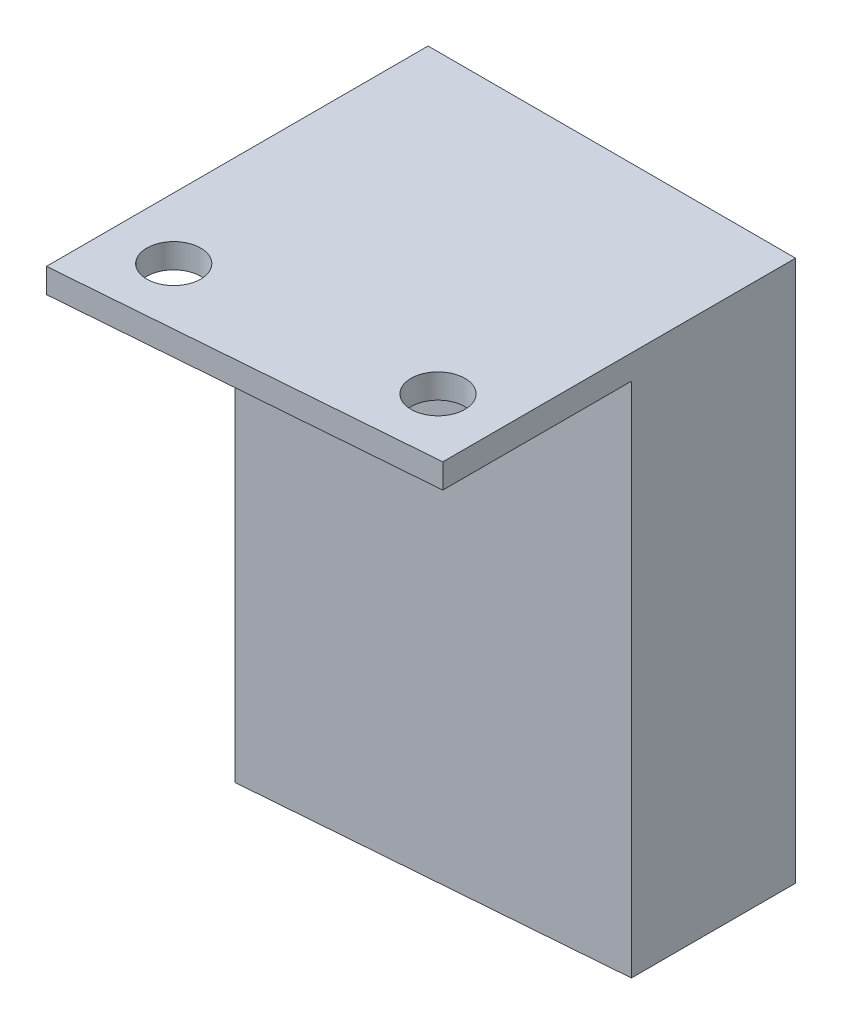
from build123d import *

# Parameters (mm, degrees)
SKETCH1_W           = 38.1
SKETCH1_H           = 25.4
BOSS_EXTRUDE1_DEPTH = 17.018
SKETCH4_W           = 38.1
SKETCH4_H           = 23.368
SKETCH4_R           = 2.794
BOSS_EXTRUDE2_DEPTH = 2.54
CUT_EXTRUDE1_DEPTH  = 62.055704041
BOSS_EXTRUDE3_DEPTH = 22.86
BOSS_EXTRUDE5_DEPTH = 30.734
SKETCH11_R          = 2.0193
CUT_EXTRUDE3_DEPTH  = 30.734
BOSS_EXTRUDE4_DEPTH = 30.734


with BuildPart() as part:
    # Sketch1 → Boss-Extrude1 (new body)
    with BuildSketch(Plane.XY):
        with Locations((19.05, 12.7)):
            Rectangle(SKETCH1_W, SKETCH1_H)
    extrude(amount=BOSS_EXTRUDE1_DEPTH)

    # Sketch4 → Boss-Extrude2 (add)
    with BuildSketch(Plane(origin=(0, 25.4, 0), x_dir=(1, 0, 0), z_dir=(0, 1, 0))):
        with Locations((19.05, -28.702)):
            Rectangle(SKETCH4_W, SKETCH4_H)
        with Locations(Location((6.35, -32.724779192, 0), (0, 0, 270))):
            Circle(SKETCH4_R, mode=Mode.SUBTRACT)
        with Locations(Location((31.75, -30.725755838, 0), (0, 0, 270))):
            Circle(SKETCH4_R, mode=Mode.SUBTRACT)
    extrude(amount=-BOSS_EXTRUDE2_DEPTH)

    # Sketch5 → Cut-Extrude1 (cut, through all)
    with BuildSketch(Plane(origin=(0, 25.4, 0), x_dir=(1, 0, 0), z_dir=(0, 1, 0))):
        Polygon((38.1, -36.576), (0, -39.57453503), (0, -40.386), (38.1, -40.386), align=None)
    extrude(amount=-CUT_EXTRUDE1_DEPTH, mode=Mode.SUBTRACT)

    # Sketch7 → Boss-Extrude3 (add)
    with BuildSketch(Plane.XZ):
        Polygon((38.1, 17.018), (0, 20.01653503), (0, 17.018), align=None)
    extrude(amount=-BOSS_EXTRUDE3_DEPTH)

    # Sketch10 → Boss-Extrude5 (add)
    with BuildSketch(Plane.XZ):
        Polygon((0, 0), (0, 20.01653503), (38.1, 17.018), (38.1, 0), align=None)
    extrude(amount=BOSS_EXTRUDE5_DEPTH)

    # Sketch11 → Cut-Extrude3 (cut)
    with BuildSketch(Plane(origin=(0, 0, 0), x_dir=(-1, 0, 0), z_dir=(0, 0, -1))):
        with Locations((-25.4, -2.794)):
            Circle(SKETCH11_R)
        with Locations((-12.7, -2.794)):
            Circle(SKETCH11_R)
    extrude(amount=-CUT_EXTRUDE3_DEPTH, mode=Mode.SUBTRACT)

    # Sketch9 → Boss-Extrude4 (add)
    with BuildSketch(Plane.XZ):
        Polygon((0, 0), (38.1, 0), (38.1, 17.018), (0, 20.01653503), align=None)
    extrude(amount=BOSS_EXTRUDE4_DEPTH)


solid = part.part
